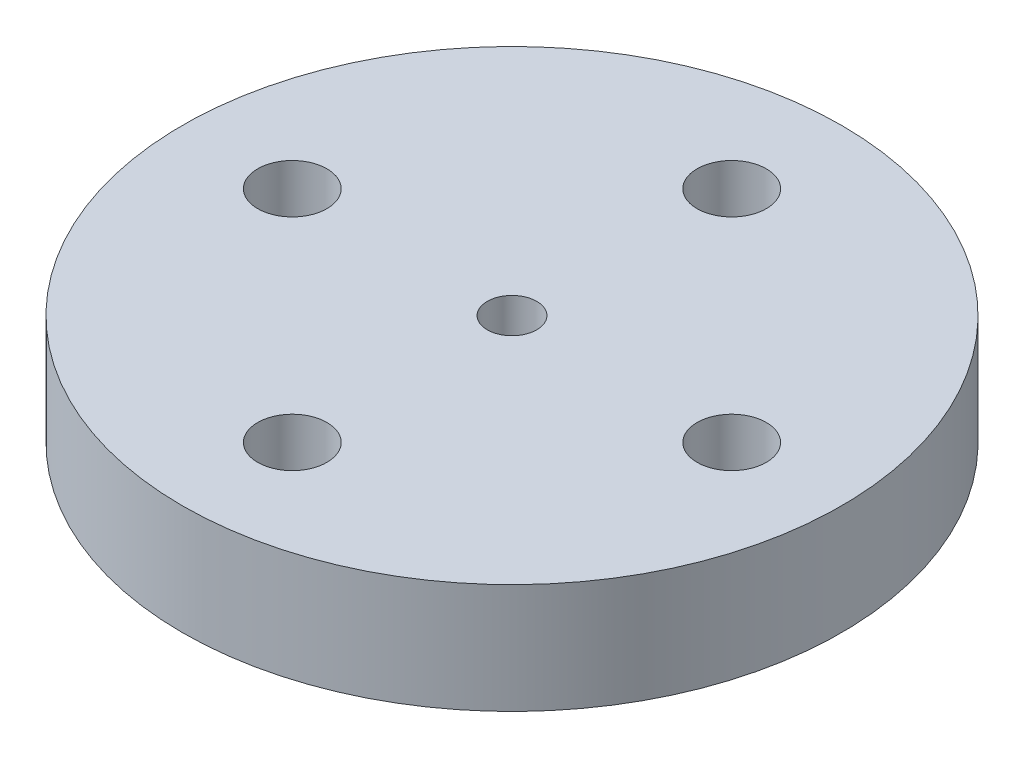
from build123d import *

# Parameters (mm, degrees)
SKETCH1_R           = 30
BOSS_EXTRUDE1_DEPTH = 10
SKETCH3_R           = 3.15
CUT_EXTRUDE2_DEPTH  = 44.588989435
SKETCH4_R           = 2.25
CUT_EXTRUDE3_DEPTH  = 10


with BuildPart() as part:
    # Sketch1 → Boss-Extrude1 (new body)
    with BuildSketch(Plane(origin=(0, 0, 0), x_dir=(1, 0, 0), z_dir=(0, 1, 0))):
        with Locations(Location((0, 0, 0), (0, 0, 270))):
            Circle(SKETCH1_R)
    extrude(amount=BOSS_EXTRUDE1_DEPTH)

    # Sketch3 → Cut-Extrude2 (cut, through all)
    with BuildSketch(Plane(origin=(0, 10, 0), x_dir=(1, 0, 0), z_dir=(0, 1, 0))):
        with Locations(Location((0, 20, 0), (0, 0, 270))):
            Circle(SKETCH3_R)
        with Locations(Location((20, 0, 0), (0, 0, 270))):
            Circle(SKETCH3_R)
        with Locations(Location((0, -20, 0), (0, 0, 270))):
            Circle(SKETCH3_R)
        with Locations(Location((-20, 0, 0), (0, 0, 270))):
            Circle(SKETCH3_R)
    extrude(amount=-CUT_EXTRUDE2_DEPTH, mode=Mode.SUBTRACT)

    # Sketch4 → Cut-Extrude3 (cut)
    with BuildSketch(Plane(origin=(0, 10, 0), x_dir=(1, 0, 0), z_dir=(0, 1, 0))):
        with Locations(Location((0, 0, 0), (0, 0, 270))):
            Circle(SKETCH4_R)
    extrude(amount=-CUT_EXTRUDE3_DEPTH, mode=Mode.SUBTRACT)


solid = part.part
